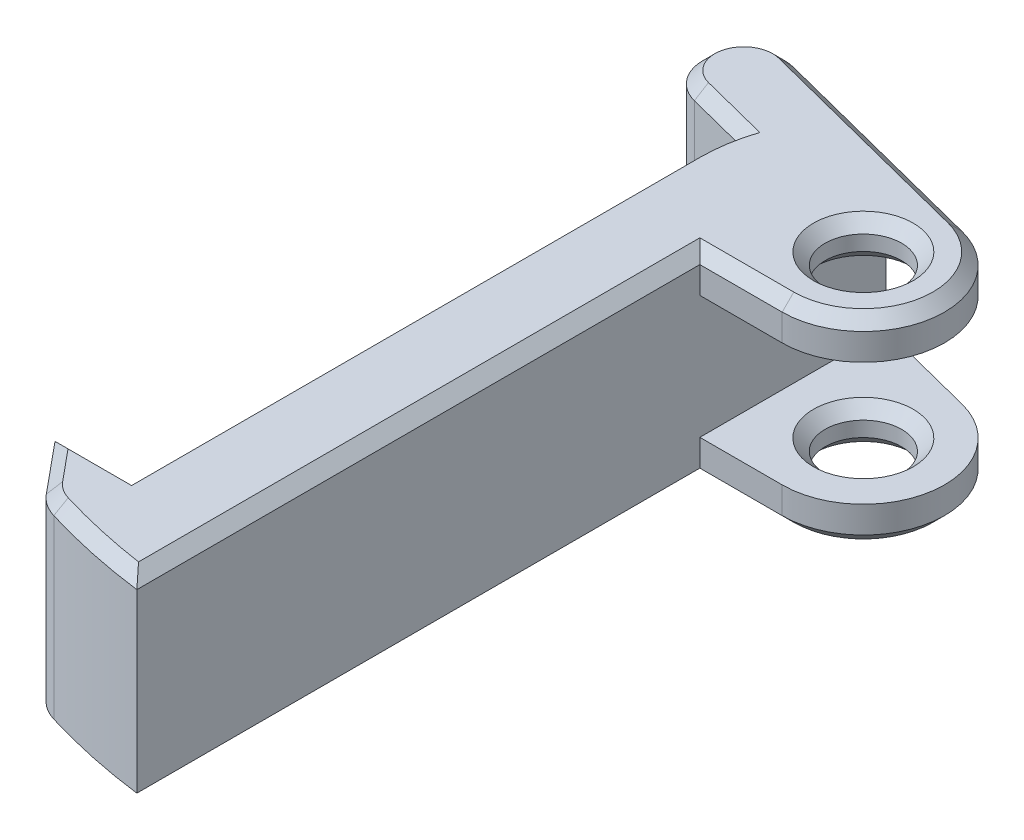
from build123d import *

# Parameters (mm, degrees)
SKETCH1_R           = 1.65
BOSS_EXTRUDE1_DEPTH = 8.6
SKETCH2_W           = 7.05
SKETCH2_H           = 5.3
CUT_EXTRUDE1_DEPTH  = 28.041671481
CHAMFER1_SIZE       = 0.5
CUT_EXTRUDE2_DEPTH  = 36.823034653
FILLET1_R           = 2
CHAMFER2_SIZE       = 0.5


with BuildPart() as part:
    # Sketch1 → Boss-Extrude1 (new body)
    with BuildSketch(Plane(origin=(0, 0, 0), x_dir=(1, 0, 0), z_dir=(0, 1, 0))):
        with BuildLine():
            Line((4.41627224, 31.391101946), (-5.369479089, 33.890916124))
            ThreePointArc((-5.369479089, 33.890916124), (-7.498166182, 32.628501271), (-6.235751329, 30.499814178))
            Line((-6.235751329, 30.499814178), (-3.76509134, 29.868672975))
            ThreePointArc((-3.76509134, 29.868672975), (-3.941042638, 28.941690072), (-4, 28))
            Line((-4, 28), (-4, 4))
            Line((-4, 4), (-7.3, 4))
            Line((-7.3, 4), (-4, 0))
            Line((-4, 0), (0, 0))
            Line((0, 0), (0, 24.5))
            Line((0, 24.5), (3.55, 24.5))
            ThreePointArc((3.55, 24.5), (7.022668773, 27.563454934), (4.41627224, 31.391101946))
        make_face()
        with Locations(Location((3.55, 28, 0), (0, 0, 90))):
            Circle(SKETCH1_R, mode=Mode.SUBTRACT)
    extrude(amount=BOSS_EXTRUDE1_DEPTH)

    # Sketch2 → Cut-Extrude1 (cut, through all)
    with BuildSketch(Plane.XY.offset(-24.5)):
        with Locations((3.525, 4.3)):
            Rectangle(SKETCH2_W, SKETCH2_H)
    extrude(amount=-CUT_EXTRUDE1_DEPTH, mode=Mode.SUBTRACT)

    # Chamfer1
    chamfer1_edges = [part.edges().sort_by_distance(p)[0] for p in [
        (3.55, 0, -26.35),
        (3.55, 8.6, -26.35),
        (3.55, 6.95, -26.35),
        (3.55, 1.65, -26.35),
    ]]
    chamfer(chamfer1_edges, length=CHAMFER1_SIZE)

    # Sketch3 → Cut-Extrude2 (cut, through all)
    with BuildSketch(Plane(origin=(0, 0, 0), x_dir=(1, 0, 0), z_dir=(0, 1, 0))):
        with BuildLine():
            Line((0, 0.225956362), (0, 0))
            Line((0, 0), (-4, 0))
            Line((-4, 0), (-5.140926966, 1.382941776))
            ThreePointArc((-5.140926966, 1.382941776), (-2.597741622, 0.683241903), (0, 0.225956362))
        make_face()
    extrude(amount=CUT_EXTRUDE2_DEPTH, mode=Mode.SUBTRACT)

    # Fillet1
    fillet1_edges = [part.edges().sort_by_distance(p)[0] for p in [
        (-5.140926966, 4.3, -1.382941776),
    ]]
    fillet(fillet1_edges, radius=FILLET1_R)

    # Chamfer2
    chamfer2_edges = [part.edges().sort_by_distance(p)[0] for p in [
        (-5.083597869, 8.6, -1.448008405),
        (-6.409042622, 0, -2.920051663),
        (-5.65, 0, -4),
        (-4, 0, -16),
        (-3.941042638, 0, -28.941690072),
        (7.022668773, 8.6, -27.563454934),
        (-5.000421335, 0, -30.184243577),
        (-7.498166182, 0, -32.628501271),
        (-0.476603424, 0, -32.641009035),
        (7.022668773, 0, -27.563454934),
        (1.775, 0, -24.5),
        (-0.476603424, 8.6, -32.641009035),
        (-7.498166182, 8.6, -32.628501271),
        (-5.000421335, 8.6, -30.184243577),
        (-3.941042638, 8.6, -28.941690072),
        (-4, 8.6, -16),
        (-5.65, 8.6, -4),
        (-6.409042622, 8.6, -2.920051663),
        (0, 0, -12.362978181),
        (0, 8.6, -12.362978181),
        (-2.297358874, 0, -0.617370576),
        (-2.297358874, 8.6, -0.617370576),
        (1.775, 8.6, -24.5),
        (-5.083597869, 0, -1.448008405),
    ]]
    chamfer(chamfer2_edges, length=CHAMFER2_SIZE)


solid = part.part
